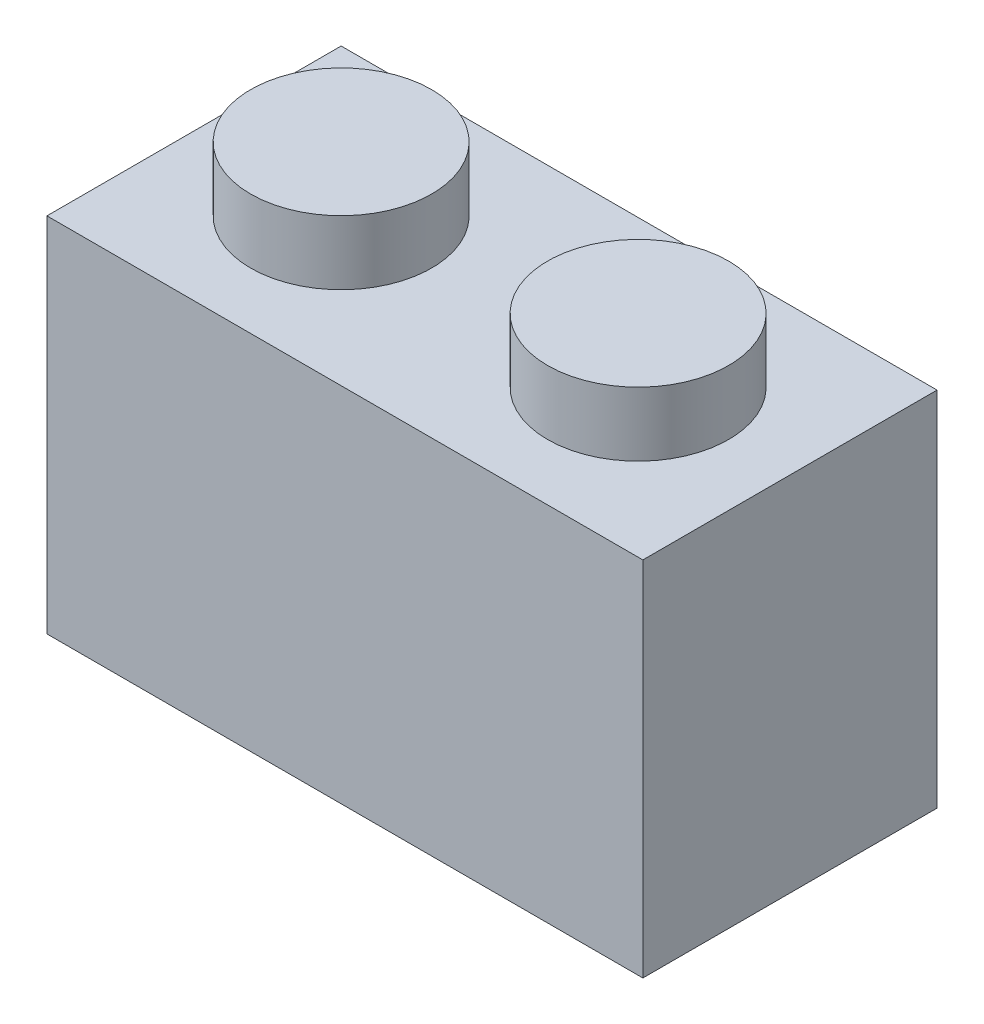
from build123d import *

# Parameters (mm, degrees)
SKETCH_1_W          = 15.8
SKETCH_1_H          = 7.8
EXTRUDE_1_DEPTH     = 9.6
SKETCH_2_R          = 2.4
EXTRUDE_2_DEPTH     = 1.7
SKETCH_3_R          = 2.5
CUT_EXTRUDE_1_DEPTH = 1.8


with BuildPart() as part:
    # Эскиз1 → Бобышка-Вытянуть1 (new body)
    with BuildSketch(Plane(origin=(0, 0, 0), x_dir=(1, 0, 0), z_dir=(0, 1, 0))):
        Rectangle(SKETCH_1_W, SKETCH_1_H)
    extrude(amount=EXTRUDE_1_DEPTH)

    # Эскиз2 → Бобышка-Вытянуть2 (add)
    with BuildSketch(Plane(origin=(0, 9.6, 0), x_dir=(1, 0, 0), z_dir=(0, 1, 0))):
        with Locations(Location((-4, 0, 0), (0, 0, 270))):
            Circle(SKETCH_2_R)
        with Locations(Location((3.874, 0, 0), (0, 0, 270))):
            Circle(SKETCH_2_R)
    extrude(amount=EXTRUDE_2_DEPTH)

    # Эскиз3 → Вырез-Вытянуть1 (cut)
    with BuildSketch(Plane.XZ):
        with Locations(Location((-4, 0, 0), (0, 0, 270))):
            Circle(SKETCH_3_R)
        with Locations(Location((3.874, 0, 0), (0, 0, 270))):
            Circle(SKETCH_3_R)
    extrude(amount=-CUT_EXTRUDE_1_DEPTH, mode=Mode.SUBTRACT)


solid = part.part
